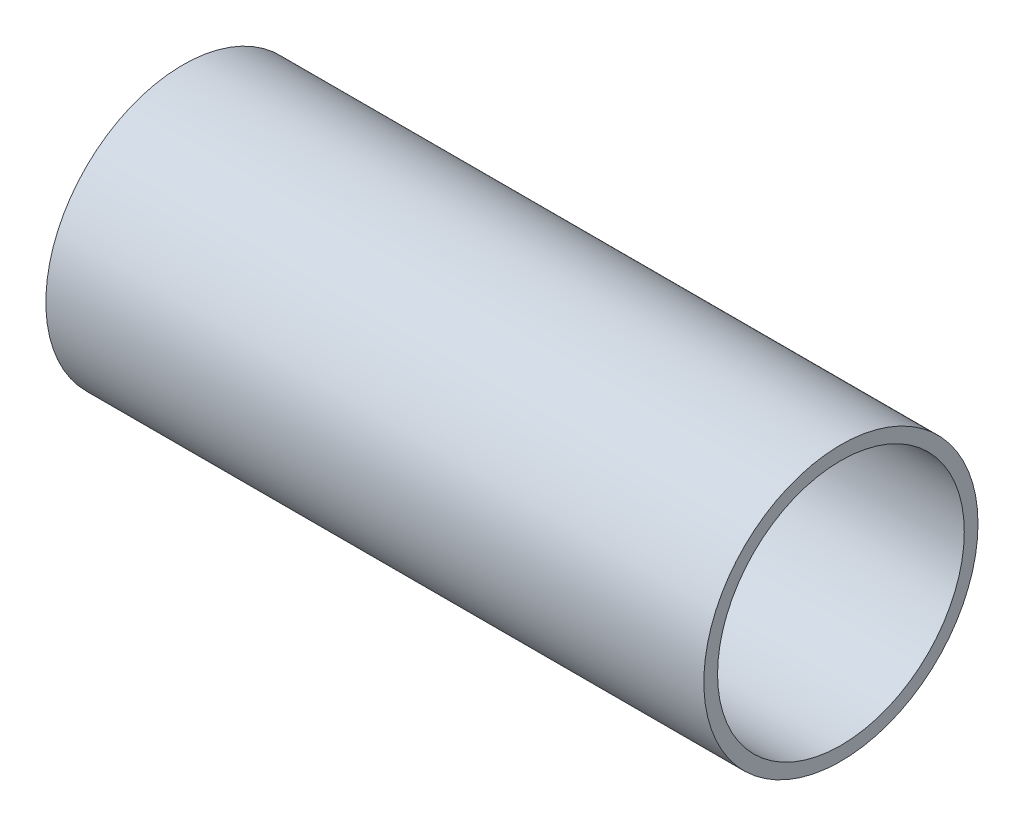
from build123d import *

# Parameters (mm, degrees)
SKETCH2_R           = 25
SKETCH2_R_2         = 22.5
BOSS_EXTRUDE1_DEPTH = 120


with BuildPart() as part:
    # Sketch2 → Boss-Extrude1 (new body)
    with BuildSketch(Plane(origin=(0, 0, 0), x_dir=(0, 0, -1), z_dir=(1, 0, 0))):
        Circle(SKETCH2_R)
        Circle(SKETCH2_R_2, mode=Mode.SUBTRACT)
    extrude(amount=BOSS_EXTRUDE1_DEPTH)


solid = part.part
